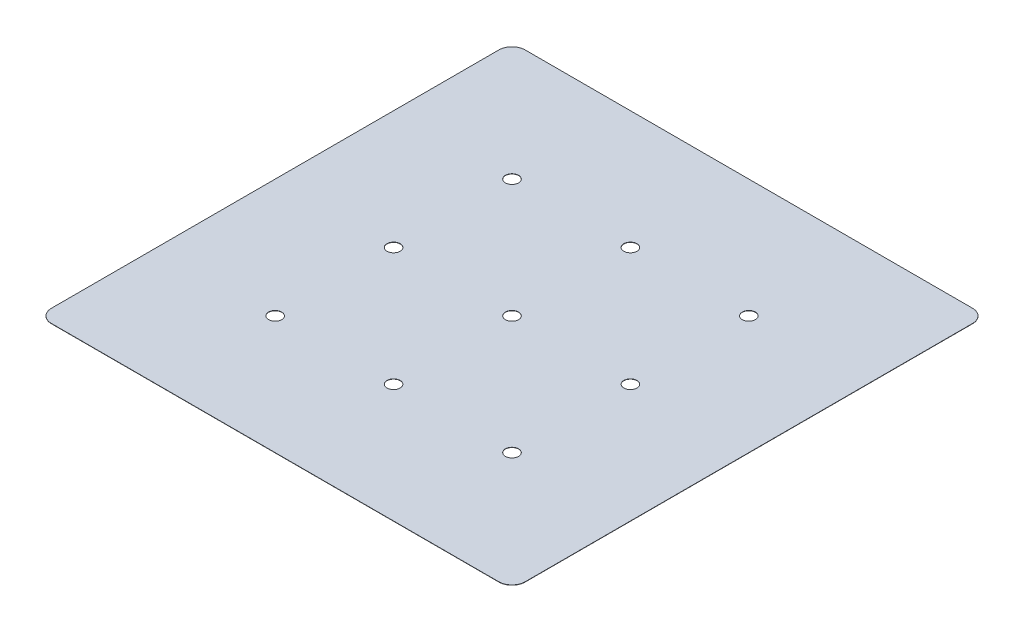
from build123d import *

# Parameters (mm, degrees)
BOSS_EXTRUDE1_DEPTH = 0.2


with BuildPart() as part:
    # Sketch1 → Boss-Extrude1 (new body)
    with BuildSketch(Plane(origin=(0, 0, 0), x_dir=(1, 0, 0), z_dir=(0, 1, 0))):
        with BuildLine():
            Line((-90, 95), (-90, 180))
            Line((-90, 180), (-170, 180))
            ThreePointArc((-170, 180), (-177.071067812, 177.071067812), (-180, 170))
            Line((-180, 170), (-180, 90))
            Line((-180, 90), (-95, 90))
            ThreePointArc((-95, 90), (-93.535533906, 93.535533906), (-90, 95))
        make_face()
        with BuildLine():
            Line((0, 180), (-90, 180))
            Line((-90, 180), (-90, 95))
            ThreePointArc((-90, 95), (-86.464466094, 93.535533906), (-85, 90))
            Line((-85, 90), (-5, 90))
            ThreePointArc((-5, 90), (-3.535533906, 93.535533906), (0, 95))
            Line((0, 95), (0, 180))
        make_face()
        with BuildLine():
            Line((-5, 90), (-85, 90))
            ThreePointArc((-85, 90), (-86.464466094, 86.464466094), (-90, 85))
            Line((-90, 85), (-90, 5))
            ThreePointArc((-90, 5), (-86.464466094, 3.535533906), (-85, 0))
            Line((-85, 0), (-5, 0))
            ThreePointArc((-5, 0), (-3.535533906, 3.535533906), (0, 5))
            Line((0, 5), (0, 85))
            ThreePointArc((0, 85), (-3.535533906, 86.464466094), (-5, 90))
        make_face()
        with BuildLine():
            ThreePointArc((-90, 85), (-93.535533906, 86.464466094), (-95, 90))
            Line((-95, 90), (-180, 90))
            Line((-180, 90), (-180, 0))
            Line((-180, 0), (-95, 0))
            ThreePointArc((-95, 0), (-93.535533906, 3.535533906), (-90, 5))
            Line((-90, 5), (-90, 85))
        make_face()
        with BuildLine():
            Line((-95, 0), (-180, 0))
            Line((-180, 0), (-180, -90))
            Line((-180, -90), (-95, -90))
            ThreePointArc((-95, -90), (-93.535533906, -86.464466094), (-90, -85))
            Line((-90, -85), (-90, -5))
            ThreePointArc((-90, -5), (-93.535533906, -3.535533906), (-95, 0))
        make_face()
        with BuildLine():
            Line((-95, -90), (-180, -90))
            Line((-180, -90), (-180, -170))
            ThreePointArc((-180, -170), (-177.071067812, -177.071067812), (-170, -180))
            Line((-170, -180), (-90, -180))
            Line((-90, -180), (-90, -95))
            ThreePointArc((-90, -95), (-93.535533906, -93.535533906), (-95, -90))
        make_face()
        with BuildLine():
            ThreePointArc((-85, -90), (-86.464466094, -93.535533906), (-90, -95))
            Line((-90, -95), (-90, -180))
            Line((-90, -180), (0, -180))
            Line((0, -180), (0, -95))
            ThreePointArc((0, -95), (-3.535533906, -93.535533906), (-5, -90))
            Line((-5, -90), (-85, -90))
        make_face()
        with BuildLine():
            Line((-5, 0), (-85, 0))
            ThreePointArc((-85, 0), (-86.464466094, -3.535533906), (-90, -5))
            Line((-90, -5), (-90, -85))
            ThreePointArc((-90, -85), (-86.464466094, -86.464466094), (-85, -90))
            Line((-85, -90), (-5, -90))
            ThreePointArc((-5, -90), (-3.535533906, -86.464466094), (0, -85))
            Line((0, -85), (0, -5))
            ThreePointArc((0, -5), (-3.535533906, -3.535533906), (-5, 0))
        make_face()
        with BuildLine():
            Line((85, 0), (5, 0))
            ThreePointArc((5, 0), (3.535533906, -3.535533906), (0, -5))
            Line((0, -5), (0, -85))
            ThreePointArc((0, -85), (3.535533906, -86.464466094), (5, -90))
            Line((5, -90), (85, -90))
            ThreePointArc((85, -90), (86.464466094, -86.464466094), (90, -85))
            Line((90, -85), (90, -5))
            ThreePointArc((90, -5), (86.464466094, -3.535533906), (85, 0))
        make_face()
        with BuildLine():
            Line((85, -90), (5, -90))
            ThreePointArc((5, -90), (3.535533906, -93.535533906), (0, -95))
            Line((0, -95), (0, -180))
            Line((0, -180), (90, -180))
            Line((90, -180), (90, -95))
            ThreePointArc((90, -95), (86.464466094, -93.535533906), (85, -90))
        make_face()
        with BuildLine():
            Line((180, -170), (180, -90))
            Line((180, -90), (95, -90))
            ThreePointArc((95, -90), (93.535533906, -93.535533906), (90, -95))
            Line((90, -95), (90, -180))
            Line((90, -180), (170, -180))
            ThreePointArc((170, -180), (177.071067812, -177.071067812), (180, -170))
        make_face()
        with BuildLine():
            Line((180, -90), (180, 0))
            Line((180, 0), (95, 0))
            ThreePointArc((95, 0), (93.535533906, -3.535533906), (90, -5))
            Line((90, -5), (90, -85))
            ThreePointArc((90, -85), (93.535533906, -86.464466094), (95, -90))
            Line((95, -90), (180, -90))
        make_face()
        with BuildLine():
            Line((85, 90), (5, 90))
            ThreePointArc((5, 90), (3.535533906, 86.464466094), (0, 85))
            Line((0, 85), (0, 5))
            ThreePointArc((0, 5), (3.535533906, 3.535533906), (5, 0))
            Line((5, 0), (85, 0))
            ThreePointArc((85, 0), (86.464466094, 3.535533906), (90, 5))
            Line((90, 5), (90, 85))
            ThreePointArc((90, 85), (86.464466094, 86.464466094), (85, 90))
        make_face()
        with BuildLine():
            Line((180, 90), (95, 90))
            ThreePointArc((95, 90), (93.535533906, 86.464466094), (90, 85))
            Line((90, 85), (90, 5))
            ThreePointArc((90, 5), (93.535533906, 3.535533906), (95, 0))
            Line((95, 0), (180, 0))
            Line((180, 0), (180, 90))
        make_face()
        with BuildLine():
            Line((170, 180), (90, 180))
            Line((90, 180), (90, 95))
            ThreePointArc((90, 95), (93.535533906, 93.535533906), (95, 90))
            Line((95, 90), (180, 90))
            Line((180, 90), (180, 170))
            ThreePointArc((180, 170), (177.071067812, 177.071067812), (170, 180))
        make_face()
        with BuildLine():
            Line((90, 180), (0, 180))
            Line((0, 180), (0, 95))
            ThreePointArc((0, 95), (3.535533906, 93.535533906), (5, 90))
            Line((5, 90), (85, 90))
            ThreePointArc((85, 90), (86.464466094, 93.535533906), (90, 95))
            Line((90, 95), (90, 180))
        make_face()
    extrude(amount=BOSS_EXTRUDE1_DEPTH)


solid = part.part
